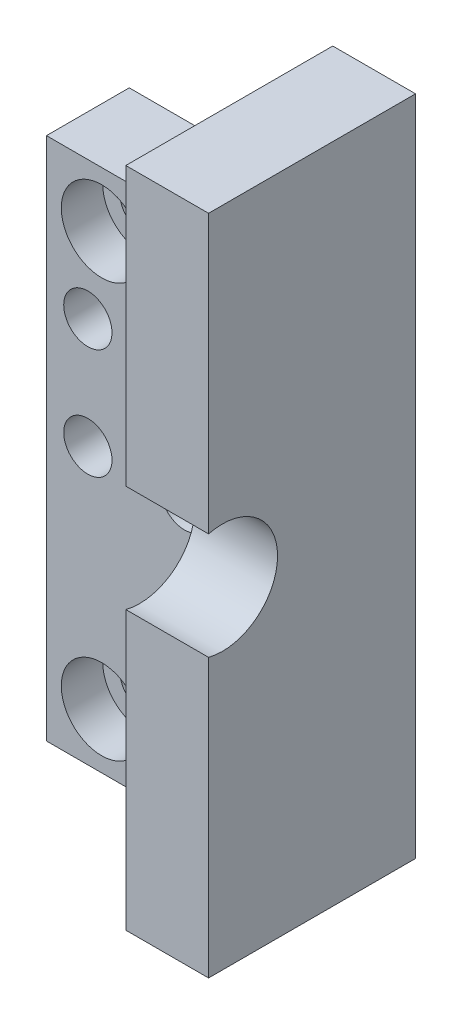
from build123d import *

# Parameters (mm, degrees)
SKETCH1_W           = 20.75
SKETCH1_H           = 48
SKETCH1_R           = 1.675
BOSS_EXTRUDE1_DEPTH = 6
SKETCH2_W           = 15
SKETCH2_H           = 48
BOSS_EXTRUDE2_DEPTH = 6
SKETCH3_R           = 4
CUT_EXTRUDE1_DEPTH  = 6
SKETCH5_R           = 2.925
CUT_EXTRUDE2_DEPTH  = 3
SKETCH6_R           = 1.75
CUT_EXTRUDE3_DEPTH  = 10
SKETCH7_W           = 3.5
SKETCH7_H           = 8
CUT_EXTRUDE4_DEPTH  = 2.5
SKETCH8_W           = 14.75
SKETCH8_H           = 10
CUT_EXTRUDE5_DEPTH  = 16
SKETCH9_W           = 15
SKETCH9_H           = 48
CUT_EXTRUDE6_DEPTH  = 20.75


with BuildPart() as part:
    # Sketch1 → Boss-Extrude1 (new body)
    with BuildSketch(Plane.XY):
        with Locations((10.375, 24)):
            Rectangle(SKETCH1_W, SKETCH1_H)
        with Locations((16.75, 34)):
            Circle(SKETCH1_R, mode=Mode.SUBTRACT)
        with Locations((16.75, 4)):
            Circle(SKETCH1_R, mode=Mode.SUBTRACT)
    boss_extrude1 = extrude(amount=BOSS_EXTRUDE1_DEPTH)

    # Sketch2 → Boss-Extrude2 (add)
    with BuildSketch(Plane.ZY):
        with Locations((7.5, 24)):
            Rectangle(SKETCH2_W, SKETCH2_H)
    boss_extrude2 = extrude(amount=-BOSS_EXTRUDE2_DEPTH)

    # Sketch3 → Cut-Extrude1 (cut)
    with BuildSketch(Plane.ZY):
        with Locations((14, 24)):
            Circle(SKETCH3_R)
    cut_extrude1 = extrude(amount=-CUT_EXTRUDE1_DEPTH, mode=Mode.SUBTRACT)

    # Sketch5 → Cut-Extrude2 (cut)
    with BuildSketch(Plane.XY.offset(6)):
        with Locations((16.75, 34)):
            Circle(SKETCH5_R)
        with Locations((16.75, 4)):
            Circle(SKETCH5_R)
    cut_extrude2 = extrude(amount=-CUT_EXTRUDE2_DEPTH, mode=Mode.SUBTRACT)

    # Sketch6 → Cut-Extrude3 (cut)
    with BuildSketch(Plane.XY.offset(6)):
        with Locations((10.75, 28)):
            Circle(SKETCH6_R)
        with Locations((17.75, 28)):
            Circle(SKETCH6_R)
        with Locations(Location((10.75, 20, 0), (0, 0, 180))):
            Circle(SKETCH6_R)
        with Locations(Location((17.75, 20, 0), (0, 0, 180))):
            Circle(SKETCH6_R)
    cut_extrude3 = extrude(amount=-CUT_EXTRUDE3_DEPTH, mode=Mode.SUBTRACT)

    # Sketch7 → Cut-Extrude4 (cut)
    with BuildSketch(Plane(origin=(0, 0, 0), x_dir=(-1, 0, 0), z_dir=(0, 0, -1))):
        with Locations((-17.75, 24)):
            Rectangle(SKETCH7_W, SKETCH7_H)
        with Locations((-10.75, 24)):
            Rectangle(SKETCH7_W, SKETCH7_H)
    cut_extrude4 = extrude(amount=-CUT_EXTRUDE4_DEPTH, mode=Mode.SUBTRACT)

    # Sketch8 → Cut-Extrude5 (cut)
    with BuildSketch(Plane.XY.offset(6)):
        with Locations((13.375, 43)):
            Rectangle(SKETCH8_W, SKETCH8_H)
    cut_extrude5 = extrude(amount=-CUT_EXTRUDE5_DEPTH, mode=Mode.SUBTRACT)

    # Mirror3: Boss-Extrude1, Boss-Extrude2, Cut-Extrude1, Cut-Extrude2, Cut-Extrude3, Cut-Extrude4, Cut-Extrude5 across plane
    add(boss_extrude1.mirror(Plane(origin=(20.75, 0, 6), x_dir=(0, 0, 1), z_dir=(-1, 0, 0))))
    add(boss_extrude2.mirror(Plane(origin=(20.75, 0, 6), x_dir=(0, 0, 1), z_dir=(-1, 0, 0))))
    add(cut_extrude1.mirror(Plane(origin=(20.75, 0, 6), x_dir=(0, 0, 1), z_dir=(-1, 0, 0))), mode=Mode.SUBTRACT)
    add(cut_extrude2.mirror(Plane(origin=(20.75, 0, 6), x_dir=(0, 0, 1), z_dir=(-1, 0, 0))), mode=Mode.SUBTRACT)
    add(cut_extrude3.mirror(Plane(origin=(20.75, 0, 6), x_dir=(0, 0, 1), z_dir=(-1, 0, 0))), mode=Mode.SUBTRACT)
    add(cut_extrude4.mirror(Plane(origin=(20.75, 0, 6), x_dir=(0, 0, 1), z_dir=(-1, 0, 0))), mode=Mode.SUBTRACT)
    add(cut_extrude5.mirror(Plane(origin=(20.75, 0, 6), x_dir=(0, 0, 1), z_dir=(-1, 0, 0))), mode=Mode.SUBTRACT)

    # Sketch9 → Cut-Extrude6 (cut)
    with BuildSketch(Plane.ZY):
        with Locations((7.5, 24)):
            Rectangle(SKETCH9_W, SKETCH9_H)
    extrude(amount=-CUT_EXTRUDE6_DEPTH, mode=Mode.SUBTRACT)


solid = part.part
